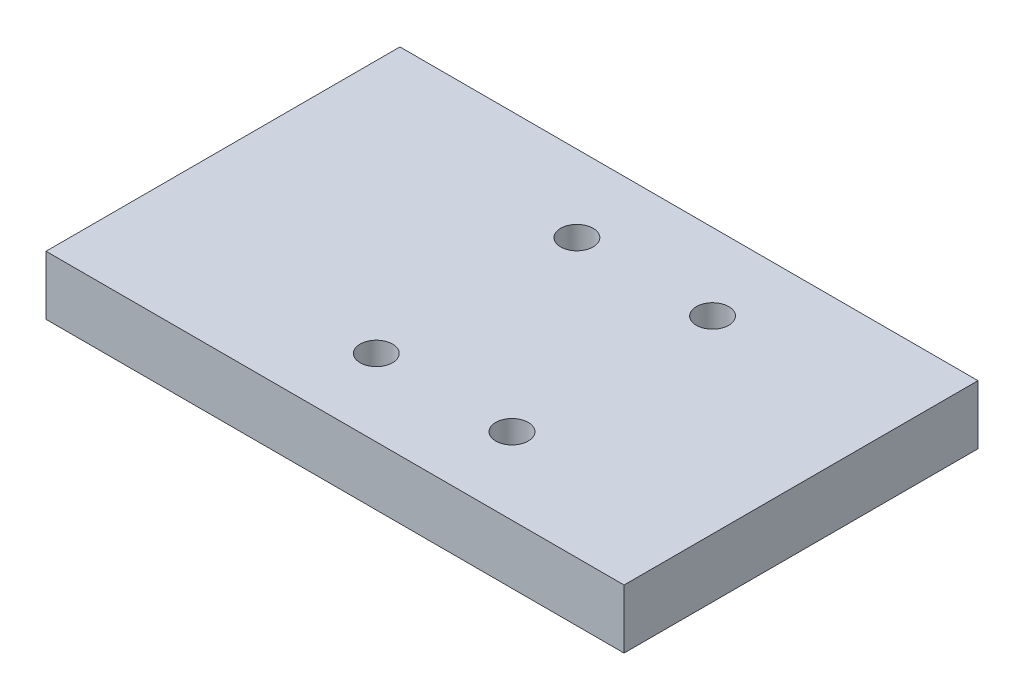
from build123d import *

# Parameters (mm, degrees)
SKETCH1_W                                           = 98
SKETCH1_H                                           = 60
BOSS_EXTRUDE1_DEPTH                                 = 10
CBORE_FOR_M5_HEX_SOCKET_HEAD_CAP_SCREW1_D           = 5.5
CBORE_FOR_M5_HEX_SOCKET_HEAD_CAP_SCREW1_CBORE_D     = 10
CBORE_FOR_M5_HEX_SOCKET_HEAD_CAP_SCREW1_CBORE_DEPTH = 5.4


with BuildPart() as part:
    # Sketch1 → Boss-Extrude1 (new body)
    with BuildSketch(Plane(origin=(0, 0, 0), x_dir=(1, 0, 0), z_dir=(0, 1, 0))):
        Rectangle(SKETCH1_W, SKETCH1_H)
    extrude(amount=BOSS_EXTRUDE1_DEPTH)

    # CBORE for M5 Hex Socket Head Cap Screw1 (through all)
    with Locations(Plane(origin=(0, 0, 0), x_dir=(-1, 0, 0), z_dir=(0, -1, 0))):
        with Locations((6, 17), (-17, 17), (-17, -17), (6, -17)):
            CounterBoreHole(CBORE_FOR_M5_HEX_SOCKET_HEAD_CAP_SCREW1_D / 2, CBORE_FOR_M5_HEX_SOCKET_HEAD_CAP_SCREW1_CBORE_D / 2, CBORE_FOR_M5_HEX_SOCKET_HEAD_CAP_SCREW1_CBORE_DEPTH)


solid = part.part
